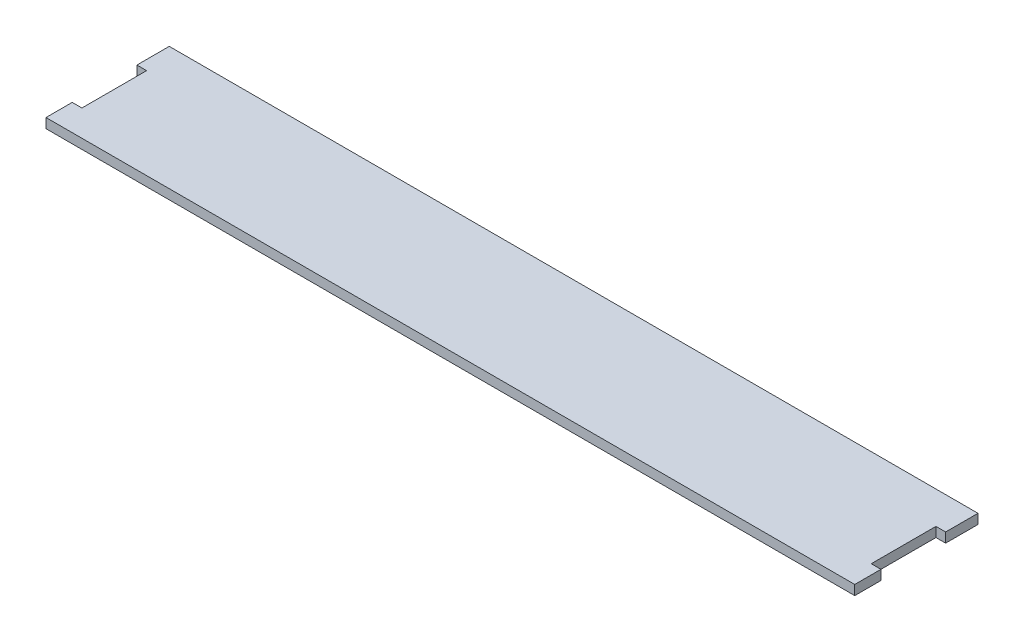
from build123d import *

# Parameters (mm, degrees)
SKETCH1_W           = 250
SKETCH1_H           = 40
BOSS_EXTRUDE1_DEPTH = 3
SKETCH2_W           = 3
SKETCH2_H           = 20
CUT_EXTRUDE1_DEPTH  = 254.197551331
CUT_EXTRUDE2_REACH  = 255.198
SKETCH4_W           = 250
SKETCH4_H           = 1.9


with BuildPart() as part:
    # Sketch1 → Boss-Extrude1 (new body)
    with BuildSketch(Plane(origin=(0, 0, 0), x_dir=(1, 0, 0), z_dir=(0, 1, 0))):
        with Locations((125, 20)):
            Rectangle(SKETCH1_W, SKETCH1_H)
    extrude(amount=BOSS_EXTRUDE1_DEPTH)

    # Sketch2 → Cut-Extrude1 (cut, through all)
    with BuildSketch(Plane(origin=(0, 3, 0), x_dir=(1, 0, 0), z_dir=(0, 1, 0))):
        with Locations((1.5, 20)):
            Rectangle(SKETCH2_W, SKETCH2_H)
        with Locations((248.5, 20)):
            Rectangle(SKETCH2_W, SKETCH2_H)
    extrude(amount=-CUT_EXTRUDE1_DEPTH, mode=Mode.SUBTRACT)

    # Sketch4 → Cut-Extrude2 (cut, up to next)
    with BuildSketch(Plane.XZ, mode=Mode.PRIVATE) as cut_extrude2_sk1:
        with Locations((125, -0.95)):
            Rectangle(SKETCH4_W, SKETCH4_H)
    cut_extrude2_tool1 = extrude(cut_extrude2_sk1.sketch, amount=-CUT_EXTRUDE2_REACH, mode=Mode.PRIVATE) & part.part
    add(cut_extrude2_tool1.solids().sort_by_distance((125, 0, -0.95))[0], mode=Mode.SUBTRACT)


solid = part.part
